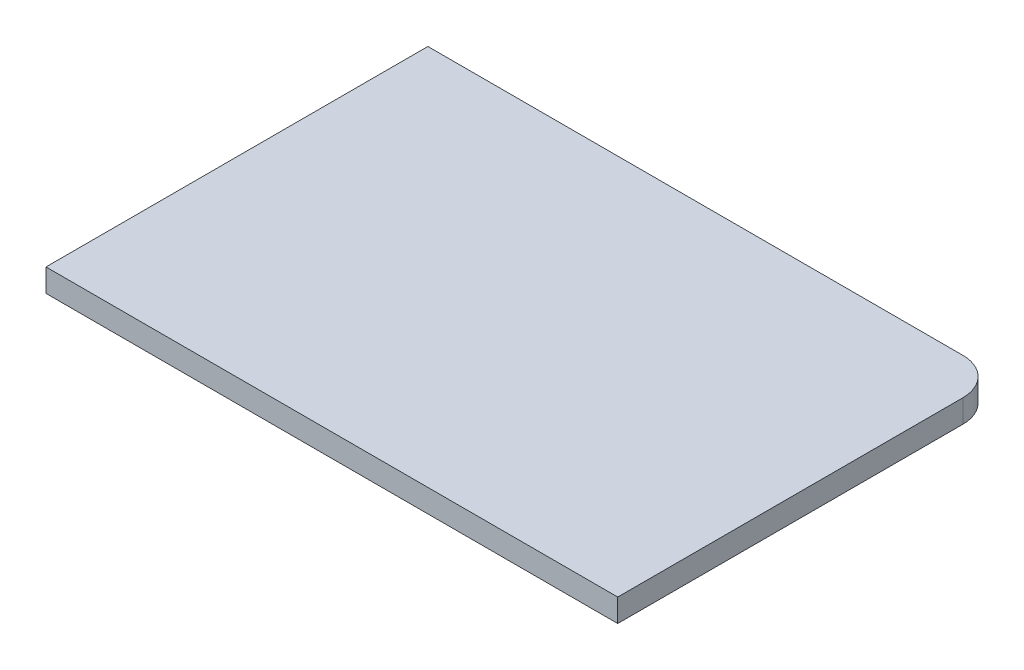
from build123d import *

# Parameters (mm, degrees)
SALIENTE_EXTRUIR1_DEPTH = 5
SALIENTE_EXTRUIR2_DEPTH = 5


with BuildPart() as part:
    # Croquis1 → Saliente-Extruir1 (new body)
    with BuildSketch(Plane(origin=(0, 0, 0), x_dir=(1, 0, 0), z_dir=(0, 1, 0))):
        with BuildLine():
            Line((-62.245, -41.575), (62.245, -41.575))
            Line((62.245, -41.575), (62.245, 33.575))
            ThreePointArc((62.245, 33.575), (59.901854249, 39.231854249), (54.245, 41.575))
            Line((54.245, 41.575), (-62.245, 41.575))
            Line((-62.245, 41.575), (-62.245, -41.575))
        make_face()
    extrude(amount=SALIENTE_EXTRUIR1_DEPTH)

    # Croquis2 → Saliente-Extruir2 (add)
    with BuildSketch(Plane(origin=(0, 0, 0), x_dir=(1, 0, 0), z_dir=(0, 1, 0))):
        with BuildLine():
            Line((52.245, -31.575), (52.245, 31.575))
            Line((52.245, 31.575), (21.4, 31.575))
            Line((21.4, 31.575), (-62.245, 31.575))
            Line((-62.245, 31.575), (-62.245, 36.575))
            Line((-62.245, 36.575), (49.245, 36.575))
            ThreePointArc((49.245, 36.575), (54.901854249, 34.231854249), (57.245, 28.575))
            Line((57.245, 28.575), (57.245, -36.575))
            Line((57.245, -36.575), (-62.245, -36.575))
            Line((-62.245, -36.575), (-62.245, -31.575))
            Line((-62.245, -31.575), (52.245, -31.575))
        make_face()
    extrude(amount=-SALIENTE_EXTRUIR2_DEPTH)


solid = part.part
